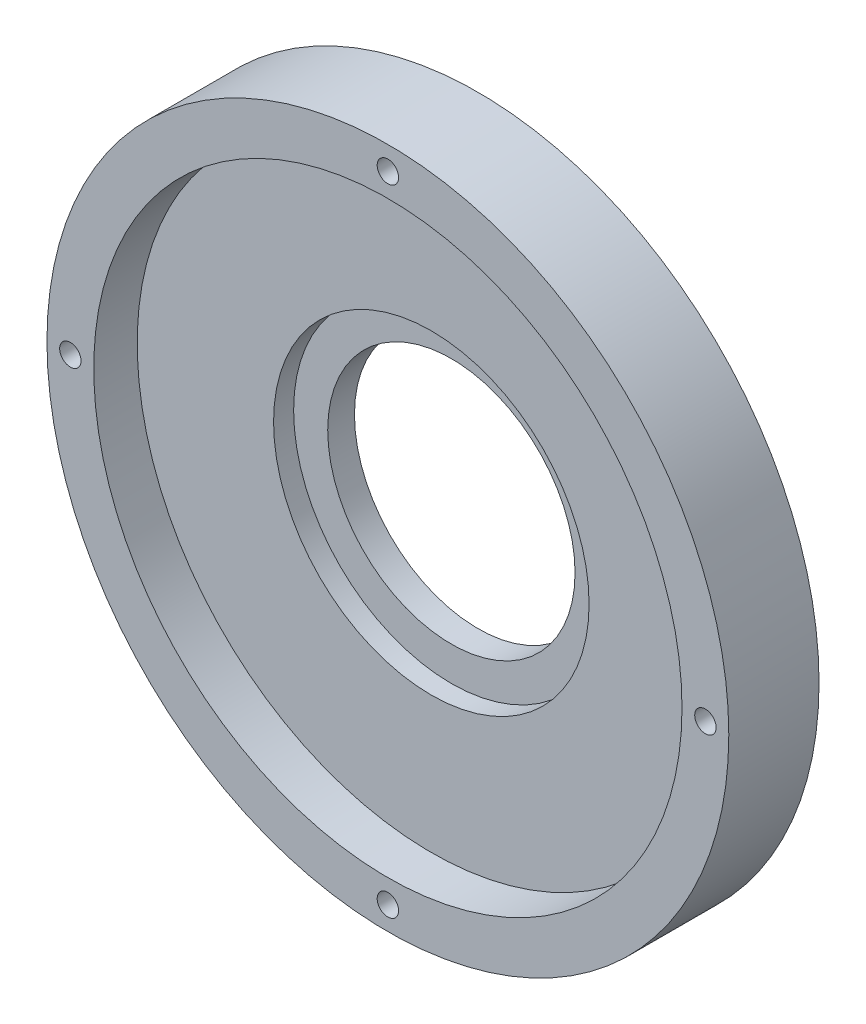
from build123d import *

# Parameters (mm, degrees)
SKETCH1_R           = 51
BOSS_EXTRUDE1_DEPTH = 13.5
SHELL1_T            = -7
SKETCH2_R           = 18.5
CUT_EXTRUDE1_DEPTH  = 7
SKETCH3_R           = 23.6
CUT_EXTRUDE2_DEPTH  = 3
SKETCH5_R           = 1.6
CUT_EXTRUDE3_DEPTH  = 13.5
SKETCH6_R           = 2.25
CUT_EXTRUDE4_DEPTH  = 6


with BuildPart() as part:
    # Sketch1 → Boss-Extrude1 (new body)
    with BuildSketch(Plane.XY):
        Circle(SKETCH1_R)
    extrude(amount=BOSS_EXTRUDE1_DEPTH)

    # Shell1
    shell1_openings = [part.faces().sort_by_distance(p)[0] for p in [
        (0, 0, 13.5),
    ]]
    offset(amount=SHELL1_T, openings=shell1_openings, kind=Kind.INTERSECTION)

    # Sketch2 → Cut-Extrude1 (cut)
    with BuildSketch(Plane(origin=(0, 0, 0), x_dir=(-1, 0, 0), z_dir=(0, 0, -1))):
        Circle(SKETCH2_R)
    extrude(amount=-CUT_EXTRUDE1_DEPTH, mode=Mode.SUBTRACT)

    # Sketch3 → Cut-Extrude2 (cut)
    with BuildSketch(Plane.XY.offset(7)):
        Circle(SKETCH3_R)
    extrude(amount=-CUT_EXTRUDE2_DEPTH, mode=Mode.SUBTRACT)

    # Sketch5 → Cut-Extrude3 (cut)
    with BuildSketch(Plane.XY.offset(13.5)):
        with Locations((0, 47.5)):
            Circle(SKETCH5_R)
        with Locations((47.5, 0)):
            Circle(SKETCH5_R)
        with Locations((0, -47.5)):
            Circle(SKETCH5_R)
        with Locations((-47.5, 0)):
            Circle(SKETCH5_R)
    extrude(amount=-CUT_EXTRUDE3_DEPTH, mode=Mode.SUBTRACT)

    # Sketch6 → Cut-Extrude4 (cut)
    with BuildSketch(Plane(origin=(0, 0, 0), x_dir=(-1, 0, 0), z_dir=(0, 0, -1))):
        with Locations((-33.587572106, 33.587572106)):
            Circle(SKETCH6_R)
        with Locations((33.587572106, 33.587572106)):
            Circle(SKETCH6_R)
        with Locations((33.587572106, -33.587572106)):
            Circle(SKETCH6_R)
        with Locations((-33.587572106, -33.587572106)):
            Circle(SKETCH6_R)
    extrude(amount=-CUT_EXTRUDE4_DEPTH, mode=Mode.SUBTRACT)


solid = part.part
